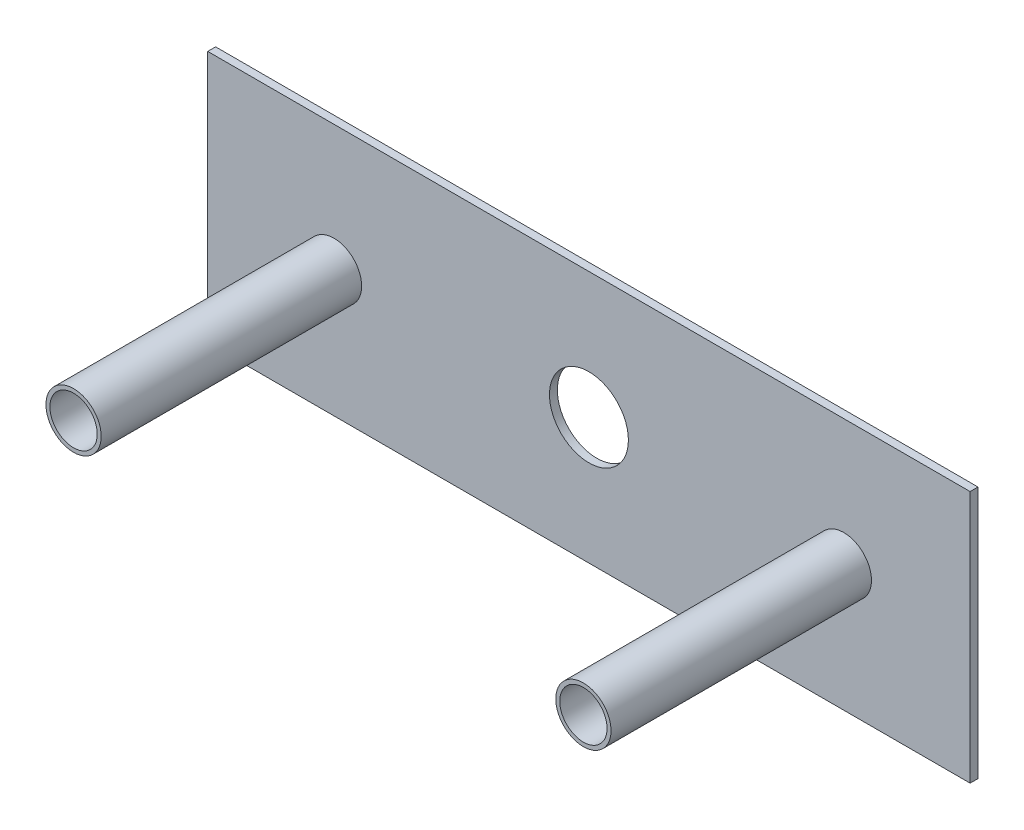
from build123d import *

# Parameters (mm, degrees)
ESQUISSE1_W             = 96.6
ESQUISSE1_H             = 32
BOSS_EXTRU_1_DEPTH      = 1
ESQUISSE6_R             = 3.5
BOSS_EXTRU_2_DEPTH      = 33
ESQUISSE7_R             = 3
ESQUISSE7_R_2           = 5
ENL_V_MAT_EXTRU_1_DEPTH = 63.350617772


with BuildPart() as part:
    # Esquisse1 → Boss.-Extru.1 (new body)
    with BuildSketch(Plane.XY):
        with Locations((0.671156739, 2.259938231)):
            Rectangle(ESQUISSE1_W, ESQUISSE1_H)
    extrude(amount=BOSS_EXTRU_1_DEPTH)

    # Esquisse6 → Boss.-Extru.2 (add)
    with BuildSketch(Plane.XY.offset(1)):
        with Locations((-31.628843261, 2.259938231)):
            Circle(ESQUISSE6_R)
        with Locations((32.971156739, 2.259938231)):
            Circle(ESQUISSE6_R)
    extrude(amount=BOSS_EXTRU_2_DEPTH)

    # Esquisse7 → Enlèv. mat.-Extru.1 (cut, through all)
    with BuildSketch(Plane.XY.offset(34)):
        with Locations((-31.628843261, 2.259938231)):
            Circle(ESQUISSE7_R)
        with Locations((32.971156739, 2.259938231)):
            Circle(ESQUISSE7_R)
        with Locations((0.671156739, 2.259938231)):
            Circle(ESQUISSE7_R_2)
    extrude(amount=-ENL_V_MAT_EXTRU_1_DEPTH, mode=Mode.SUBTRACT)


solid = part.part
